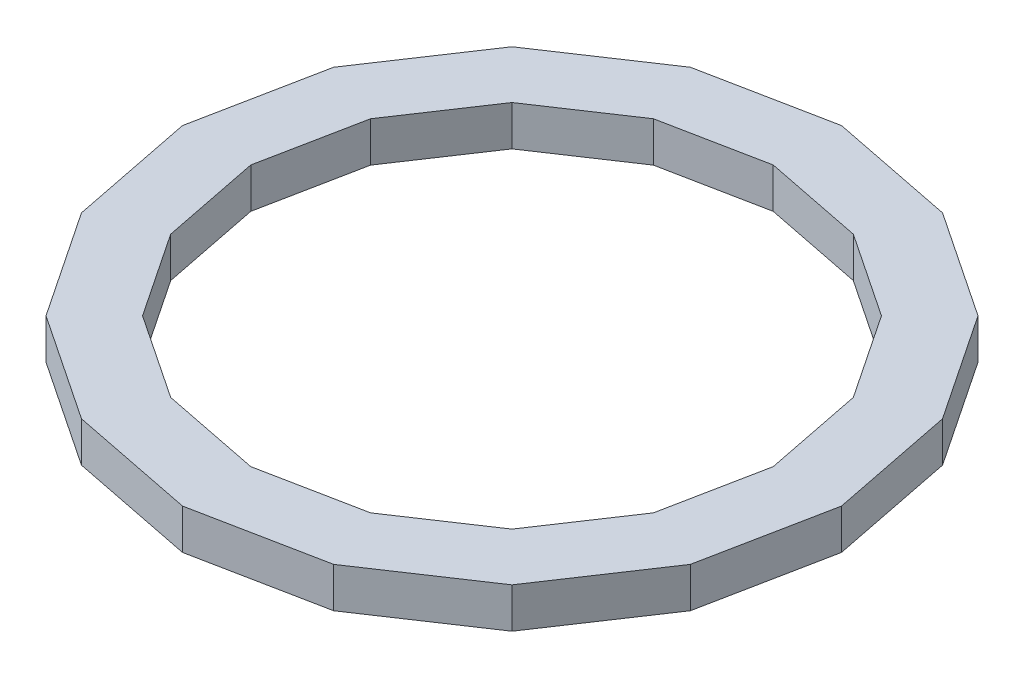
from build123d import *

# Parameters (mm, degrees)
BOSS_EXTRUDE1_DEPTH = 19.05


with BuildPart() as part:
    # Sketch1 → Boss-Extrude1 (new body)
    with BuildSketch(Plane(origin=(0, 0, 0), x_dir=(1, 0, 0), z_dir=(0, 1, 0))):
        Polygon((156.235325694, 0), (144.342619664, 59.788670693), (110.475058259, 110.475058259), (59.788670693, 144.342619664), (0, 156.235325694), (-59.788670693, 144.342619664), (-110.475058259, 110.475058259), (-144.342619664, 59.788670693), (-156.235325694, 0), (-144.342619664, -59.788670693), (-110.475058259, -110.475058259), (-59.788670693, -144.342619664), (0, -156.235325694), (59.788670693, -144.342619664), (110.475058259, -110.475058259), (144.342619664, -59.788670693), align=None)
        Polygon((123.863306421, 0), (114.434773632, 47.400435245), (87.584583911, 87.584583911), (47.400435245, 114.434773632), (0, 123.863306421), (-47.400435245, 114.434773632), (-87.584583911, 87.584583911), (-114.434773632, 47.400435245), (-123.863306421, 0), (-114.434773632, -47.400435245), (-87.584583911, -87.584583911), (-47.400435245, -114.434773632), (0, -123.863306421), (47.400435245, -114.434773632), (87.584583911, -87.584583911), (114.434773632, -47.400435245), align=None, mode=Mode.SUBTRACT)
    extrude(amount=BOSS_EXTRUDE1_DEPTH)


solid = part.part
